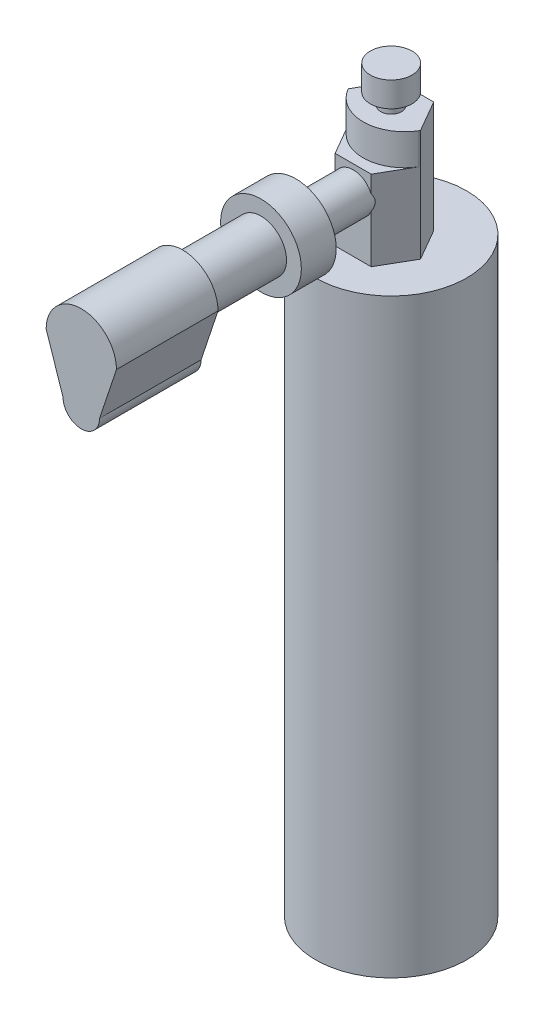
from build123d import *

# Parameters (mm, degrees)
SKETCH1_R                = 14.5
BOSS_EXTRUDE1_DEPTH      = 113.4
SKETCH2_R                = 2
BOSS_EXTRUDE2_DEPTH      = 28.5
SKETCH3_R                = 4
BOSS_EXTRUDE3_DEPTH      = 4.8
BOSS_EXTRUDE4_DEPTH      = 21.4
CUT_EXTRUDE1_DEPTH       = 6
BOSS_EXTRUDE5_DEPTH      = 11
BOSS_EXTRUDE5_DEPTH_BACK = 2
SKETCH7_R                = 3.75
SKETCH8_R                = 7.75
BOSS_EXTRUDE6_DEPTH      = 6.7
SKETCH9_R                = 4.9
BOSS_EXTRUDE7_DEPTH      = 15
BOSS_EXTRUDE8_DEPTH      = 19.5


with BuildPart() as part:
    # Sketch1 → Boss-Extrude1 (new body)
    with BuildSketch(Plane(origin=(0, 0, 0), x_dir=(1, 0, 0), z_dir=(0, 1, 0))):
        with Locations(Location((0, 0, 0), (0, 0, 90))):
            Circle(SKETCH1_R)
    extrude(amount=BOSS_EXTRUDE1_DEPTH)

    # Sketch2 → Boss-Extrude2 (add)
    with BuildSketch(Plane(origin=(0, 113.4, 0), x_dir=(1, 0, 0), z_dir=(0, 1, 0))):
        with Locations(Location((0, 0, 0), (0, 0, 90))):
            Circle(SKETCH2_R)
    extrude(amount=BOSS_EXTRUDE2_DEPTH)

    # Sketch3 → Boss-Extrude3 (add)
    with BuildSketch(Plane(origin=(0, 141.9, 0), x_dir=(1, 0, 0), z_dir=(0, 1, 0))):
        with Locations(Location((0, 0, 0), (0, 0, 270))):
            Circle(SKETCH3_R)
    extrude(amount=-BOSS_EXTRUDE3_DEPTH)

    # Sketch4 → Boss-Extrude4 (add)
    with BuildSketch(Plane(origin=(0, 113.4, 0), x_dir=(1, 0, 0), z_dir=(0, 1, 0))):
        Polygon((3.464101615, 4.7), (-3.464101615, 4.7), (-6.92820323, -1.3), (-3.464101615, -7.3), (3.464101615, -7.3), (6.92820323, -1.3), align=None)
    extrude(amount=BOSS_EXTRUDE4_DEPTH)

    # Sketch6 → Cut-Extrude1 (cut)
    with BuildSketch(Plane(origin=(0, 134.8, 0), x_dir=(1, 0, 0), z_dir=(0, 1, 0))):
        with BuildLine():
            Line((-6.92820323, -1.3), (-6.92820323, -9.46576474))
            Line((-6.92820323, -9.46576474), (6.92820323, -9.46576474))
            Line((6.92820323, -9.46576474), (6.92820323, -1.3))
            ThreePointArc((6.92820323, -1.3), (0, -5.37), (-6.92820323, -1.3))
        make_face()
    extrude(amount=-CUT_EXTRUDE1_DEPTH, mode=Mode.SUBTRACT)

    # Sketch7 → Boss-Extrude5 (add, two sides: drawn at the far end of the back side and taken through both)
    with BuildSketch(Plane.XY.offset(7.3).offset(-BOSS_EXTRUDE5_DEPTH_BACK)):
        with Locations((0, 124.05)):
            Circle(SKETCH7_R)
    extrude(amount=BOSS_EXTRUDE5_DEPTH + BOSS_EXTRUDE5_DEPTH_BACK)

    # Sketch8 → Boss-Extrude6 (add)
    with BuildSketch(Plane.XY.offset(18.3)):
        with Locations((0, 124.05)):
            Circle(SKETCH8_R)
    extrude(amount=BOSS_EXTRUDE6_DEPTH)

    # Sketch9 → Boss-Extrude7 (add)
    with BuildSketch(Plane.XY.offset(25)):
        with Locations((0, 124.05)):
            Circle(SKETCH9_R)
    extrude(amount=BOSS_EXTRUDE7_DEPTH)

    # Sketch10 → Boss-Extrude8 (add)
    with BuildSketch(Plane.XY.offset(40)):
        with BuildLine():
            Line((-6.75, 124.05), (-3.5, 114.3))
            ThreePointArc((-3.5, 114.3), (0, 110.8), (3.5, 114.3))
            Line((3.5, 114.3), (6.75, 124.05))
            ThreePointArc((6.75, 124.05), (0, 130.8), (-6.75, 124.05))
        make_face()
    extrude(amount=BOSS_EXTRUDE8_DEPTH)


solid = part.part
